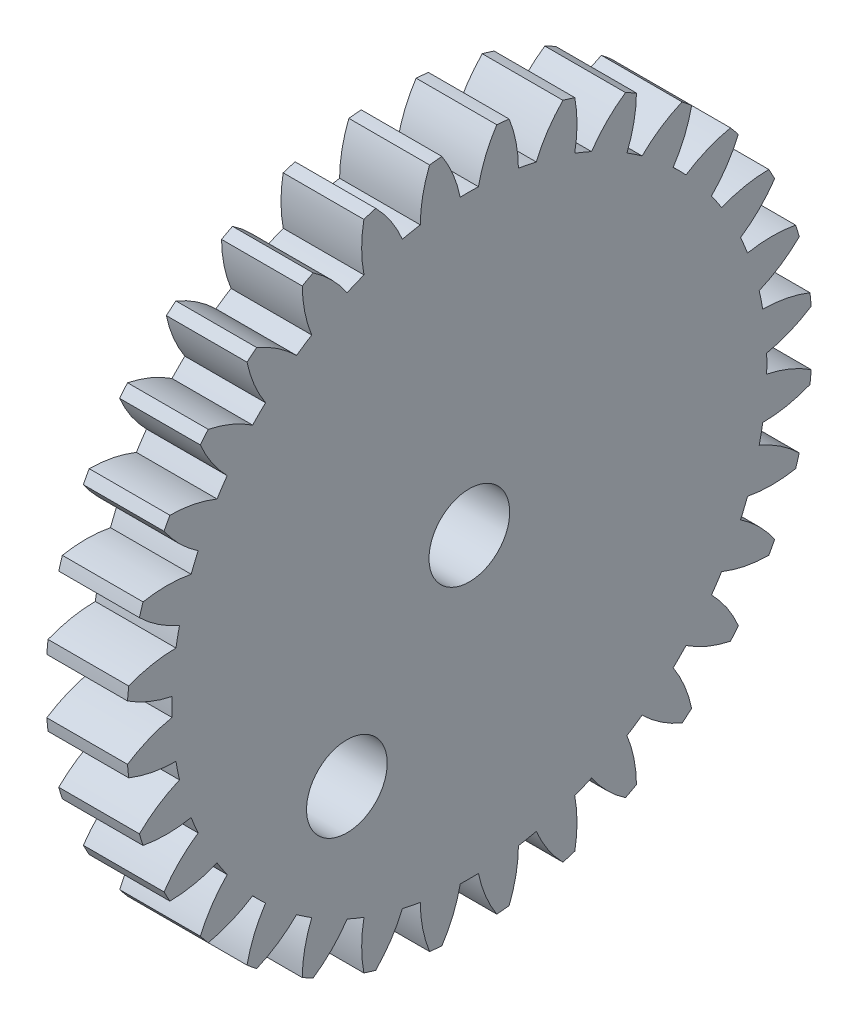
from build123d import *

# Parameters (mm, degrees)
BASPROSKE_W         = 1
BASPROSKE_H         = 4.25
TOOTHCUT_DEPTH      = 7.093028803
TEETHCUTS_COUNT     = 32
TEETHCUTS_ANGLE     = 348.75
BORSKE_R            = 0.5
BORE_DEPTH          = 50.0000508
SKETCH_1_R          = 0.5
CUT_EXTRUDE_1_DEPTH = 10


with BuildPart() as part:
    # BasProSke → Base-Revolve (revolve)
    with BuildSketch(Plane(origin=(0, 0, 0), x_dir=(1, 0, 0), z_dir=(0, 1, 0)), mode=Mode.PRIVATE) as base_revolve_sk:
        with Locations((0.5, 2.125)):
            Rectangle(BASPROSKE_W, BASPROSKE_H)
    revolve(base_revolve_sk.sketch.rotate(Axis((-10, 0, 0), (1, 0, 0)), 180), axis=Axis((-10, 0, 0), (1, 0, 0)))

    # TooCutSke → ToothCut (cut, through all)
    with BuildSketch(Plane(origin=(0, 0, 0), x_dir=(0, 0, -1), z_dir=(1, 0, 0))):
        with BuildLine():
            ThreePointArc((0.112934577, 3.684769739), (0, 3.6865), (-0.112934577, 3.684769739))
            ThreePointArc((-0.112934577, 3.684769739), (-0.206082028, 3.984644804), (-0.356003728, 4.260552371))
            ThreePointArc((-0.356003728, 4.260552371), (0, 4.2754), (0.356003728, 4.260552371))
            ThreePointArc((0.356003728, 4.260552371), (0.206082028, 3.984644804), (0.112934577, 3.684769739))
        make_face()
    toothcut = extrude(amount=TOOTHCUT_DEPTH, mode=Mode.SUBTRACT)

    # TeethCuts: ToothCut ×32 about axis
    teethcuts_axis = Axis((-10, 0, 0), (1, 0, 0))
    for i in range(1, TEETHCUTS_COUNT):
        add(toothcut.rotate(teethcuts_axis, i * TEETHCUTS_ANGLE / (TEETHCUTS_COUNT - 1)), mode=Mode.SUBTRACT)

    # BorSke → Bore (cut, symmetric)
    with BuildSketch(Plane(origin=(0, 0, 0), x_dir=(0, 0, -1), z_dir=(1, 0, 0))):
        with Locations(Location((0, 0, 0), (0, 0, 180))):
            Circle(BORSKE_R)
    extrude(amount=BORE_DEPTH, both=True, mode=Mode.SUBTRACT)

    # 草圖1 → 除料-伸長1 (cut)
    with BuildSketch(Plane(origin=(1, 0, 0), x_dir=(0, 0, -1), z_dir=(1, 0, 0))):
        with Locations((-1.517800429, -1.935489694)):
            Circle(SKETCH_1_R)
    extrude(amount=-CUT_EXTRUDE_1_DEPTH, mode=Mode.SUBTRACT)


solid = part.part
